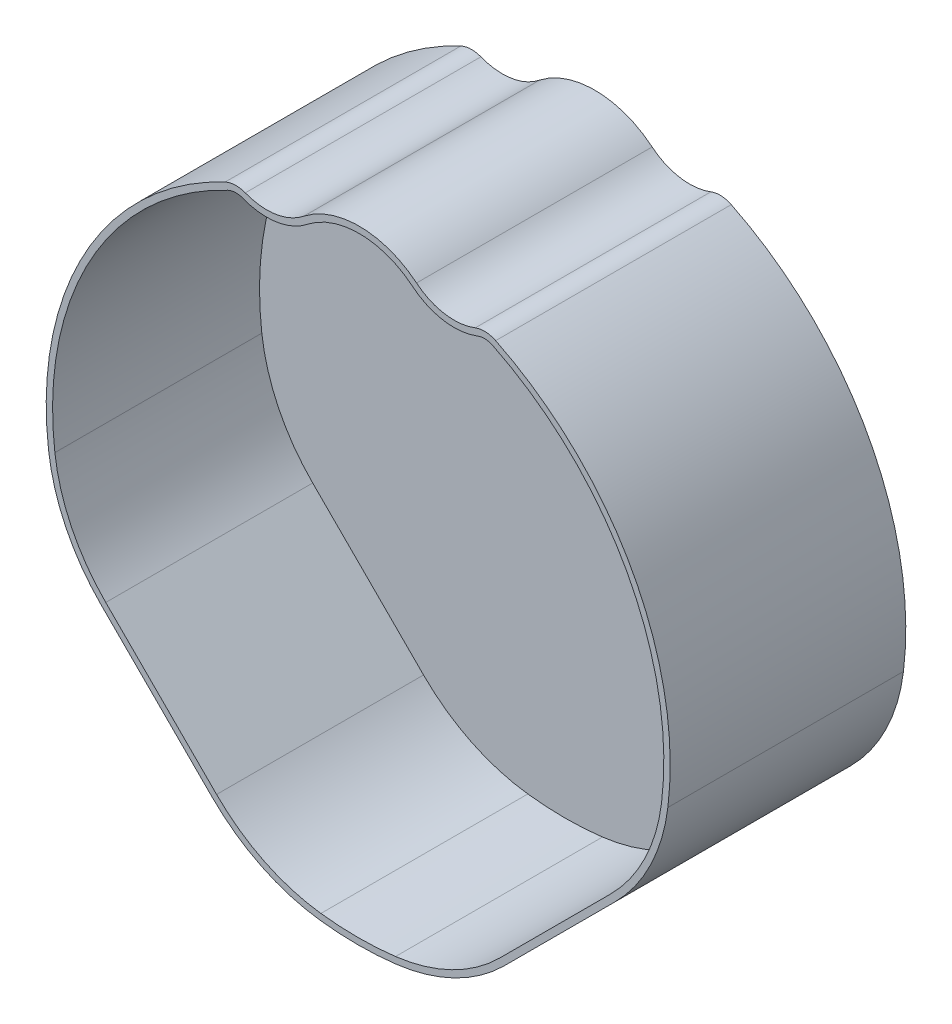
from build123d import *

# Parameters (mm, degrees)
BOSS_EXTRUDE1_DEPTH = 37
CUT_EXTRUDE1_DEPTH  = 32.5


with BuildPart() as part:
    # Sketch1 → Boss-Extrude1 (new body)
    with BuildSketch(Plane.XY):
        with BuildLine():
            Line((40.356535193, -22.947426174), (22.947426174, -40.356535193))
            ThreePointArc((22.947426174, -40.356535193), (15.156681171, -45.914203278), (5.981257322, -48.63357442))
            ThreePointArc((5.981257322, -48.63357442), (0, -49), (-5.981257322, -48.63357442))
            ThreePointArc((-5.981257322, -48.63357442), (-15.156681171, -45.914203278), (-22.947426174, -40.356535193))
            Line((-22.947426174, -40.356535193), (-40.356535193, -22.947426174))
            ThreePointArc((-40.356535193, -22.947426174), (-45.914203278, -15.156681171), (-48.63357442, -5.981257322))
            ThreePointArc((-48.63357442, -5.981257322), (-42.907888217, 23.662483572), (-20.892307913, 44.322809817))
            ThreePointArc((-20.892307913, 44.322809817), (-19.322951214, 44.702303901), (-17.73141344, 44.430451502))
            ThreePointArc((-17.73141344, 44.430451502), (-12.910393927, 43.910800792), (-8.488178405, 45.899839725))
            ThreePointArc((-8.488178405, 45.899839725), (0.386708758, 48.850803922), (9.16390657, 45.62084875))
            ThreePointArc((9.16390657, 45.62084875), (13.572775182, 43.625772556), (18.385878971, 44.128249799))
            ThreePointArc((18.385878971, 44.128249799), (20.002215513, 44.392928913), (21.589134046, 43.987603835))
            ThreePointArc((21.589134046, 43.987603835), (43.093258956, 23.323186587), (48.63357442, -5.981257322))
            ThreePointArc((48.63357442, -5.981257322), (45.914203278, -15.156681171), (40.356535193, -22.947426174))
        make_face()
    extrude(amount=BOSS_EXTRUDE1_DEPTH)

    # Sketch3 → Cut-Extrude1 (cut)
    with BuildSketch(Plane.XY.offset(37)):
        with BuildLine():
            Line((-39.649428412, -22.240319392), (-22.240319392, -39.649428412))
            ThreePointArc((-22.240319392, -39.649428412), (-14.718220769, -45.015452769), (-5.859190846, -47.641052493))
            ThreePointArc((-5.859190846, -47.641052493), (0, -48), (5.859190846, -47.641052493))
            ThreePointArc((5.859190846, -47.641052493), (14.718220769, -45.015452769), (22.240319392, -39.649428412))
            Line((22.240319392, -39.649428412), (39.649428412, -22.240319392))
            ThreePointArc((39.649428412, -22.240319392), (45.015452769, -14.718220769), (47.641052493, -5.859190846))
            ThreePointArc((47.641052493, -5.859190846), (42.213804691, 22.847203188), (21.148539474, 43.089897634))
            ThreePointArc((21.148539474, 43.089897634), (19.958350574, 43.393891443), (18.746098167, 43.195382107))
            ThreePointArc((18.746098167, 43.195382107), (13.413001918, 42.638618817), (8.52781313, 44.849236713))
            ThreePointArc((8.52781313, 44.849236713), (0.378047137, 47.850813988), (-7.865478644, 45.117238565))
            ThreePointArc((-7.865478644, 45.117238565), (-12.761098878, 42.921980343), (-18.095263428, 43.498993941))
            ThreePointArc((-18.095263428, 43.498993941), (-19.288916758, 43.702883241), (-20.465934283, 43.418262678))
            ThreePointArc((-20.465934283, 43.418262678), (-42.032217029, 23.179575744), (-47.641052493, -5.859190846))
            ThreePointArc((-47.641052493, -5.859190846), (-45.015452769, -14.718220769), (-39.649428412, -22.240319392))
        make_face()
    extrude(amount=-CUT_EXTRUDE1_DEPTH, mode=Mode.SUBTRACT)


solid = part.part
